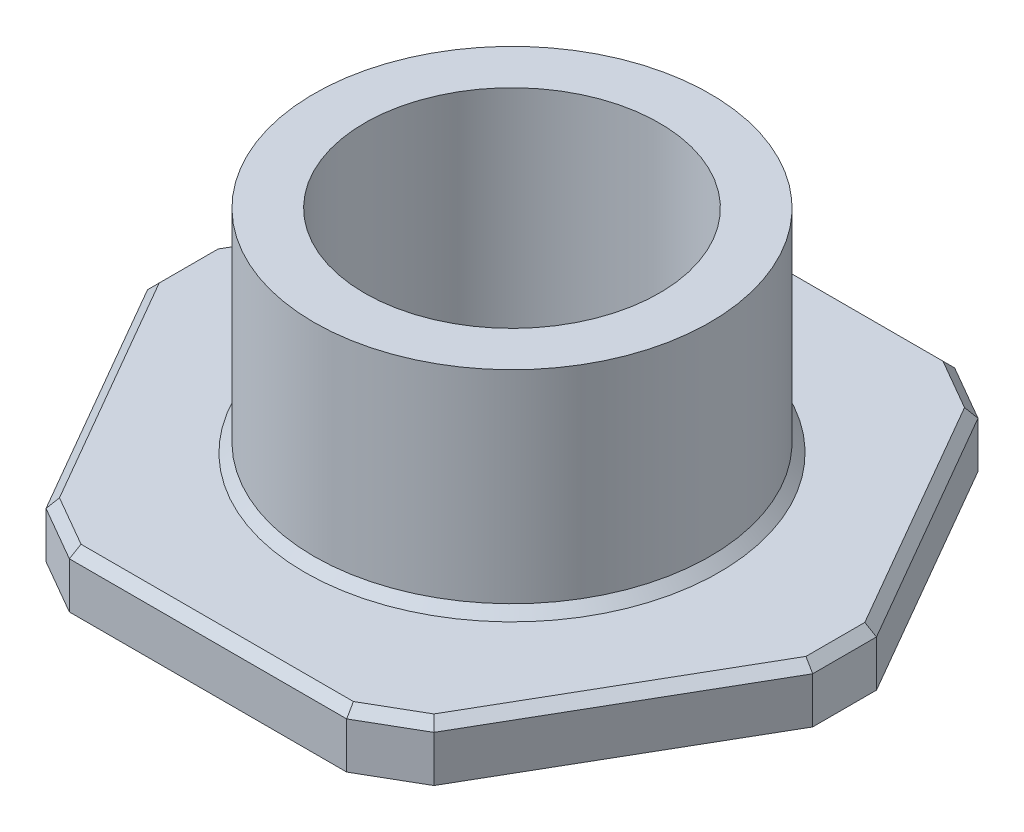
from build123d import *

# Parameters (mm, degrees)
SKETCH1_R           = 16
BOSS_EXTRUDE1_DEPTH = 6
SKETCH2_R           = 21.5
SKETCH2_R_2         = 16
BOSS_EXTRUDE2_DEPTH = 23
CHAMFER1_SIZE       = 4
CHAMFER3_SIZE       = 1


with BuildPart() as part:
    # Sketch1 → Boss-Extrude1 (new body)
    with BuildSketch(Plane(origin=(0, 0, 0), x_dir=(1, 0, 0), z_dir=(0, 1, 0))):
        Polygon((38.105117767, 0), (19.052558883, 33), (-19.052558883, 33), (-38.105117767, 0), (-19.052558883, -33), (19.052558883, -33), align=None)
        with Locations(Location((0, 0, 0), (0, 0, 270))):
            Circle(SKETCH1_R, mode=Mode.SUBTRACT)
    extrude(amount=BOSS_EXTRUDE1_DEPTH)

    # Sketch2 → Boss-Extrude2 (add)
    with BuildSketch(Plane(origin=(0, 6, 0), x_dir=(1, 0, 0), z_dir=(0, 1, 0))):
        with Locations(Location((0, 0, 0), (0, 0, 270))):
            Circle(SKETCH2_R)
        with Locations(Location((0, 0, 0), (0, 0, 270))):
            Circle(SKETCH2_R_2, mode=Mode.SUBTRACT)
    extrude(amount=BOSS_EXTRUDE2_DEPTH)

    # Chamfer1
    chamfer1_edges = [part.edges().sort_by_distance(p)[0] for p in [
        (19.052558883, 3, 33),
        (-19.052558883, 3, 33),
        (-38.105117767, 3, 0),
        (-19.052558883, 3, -33),
        (19.052558883, 3, -33),
        (38.105117767, 3, 0),
    ]]
    chamfer(chamfer1_edges, length=CHAMFER1_SIZE)

    # Chamfer3
    chamfer3_edges = [part.edges().sort_by_distance(p)[0] for p in [
        (0, 6, -21.5),
        (-28.578838325, 6, 16.5),
        (-28.578838325, 6, -16.5),
        (28.578838325, 6, 16.5),
        (28.578838325, 6, -16.5),
        (0, 6, -33),
        (0, 6, 33),
        (-18.052558883, 6, -31.267949192),
        (18.052558883, 6, -31.267949192),
        (36.105117767, 6, 0),
        (18.052558883, 6, 31.267949192),
        (-18.052558883, 6, 31.267949192),
        (-36.105117767, 6, 0),
    ]]
    chamfer(chamfer3_edges, length=CHAMFER3_SIZE)


solid = part.part
